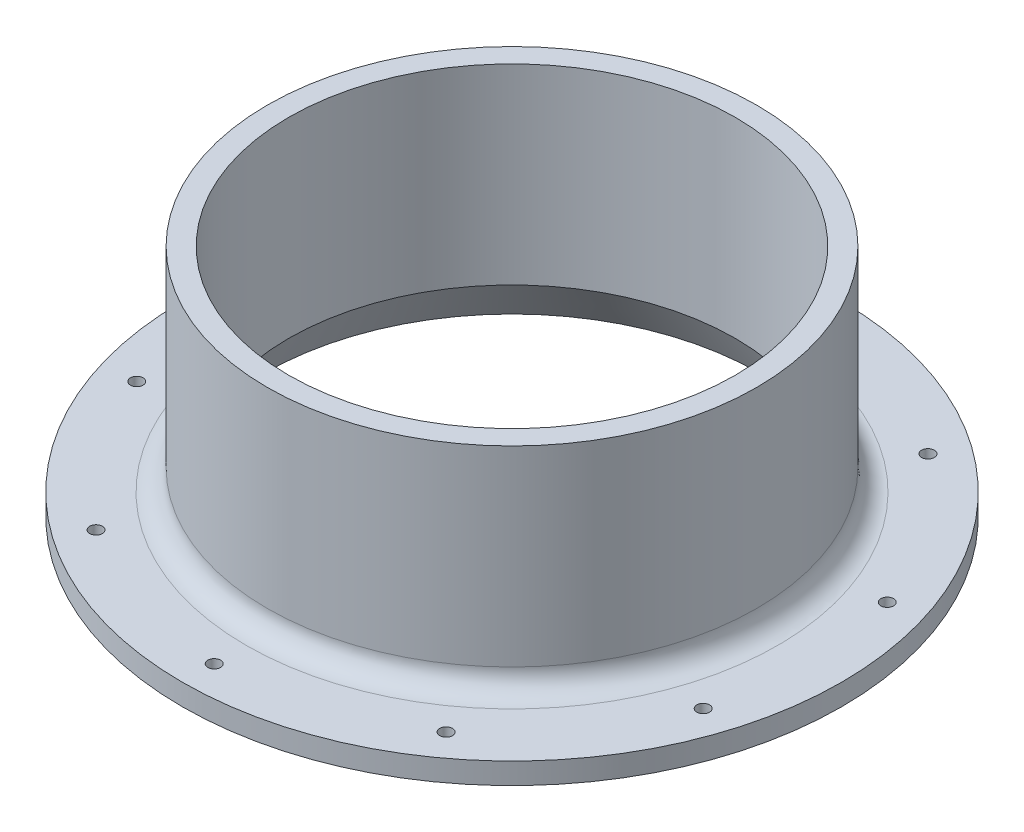
from build123d import *

# Parameters (mm, degrees)
SKETCH2_R                    = 98.425
SKETCH2_R_2                  = 66.675
BOSS_EXTRUDE1_DEPTH          = 6.35
BOSS_EXTRUDE2_START          = 63.5
SKETCH2_3_R                  = 73.025
SKETCH2_3_R_2                = 66.675
BOSS_EXTRUDE2_DEPTH          = 63.5
FILLET1_R                    = 6.35
SKETCH2_5_R                  = 1.9
CUT_EXTRUDE2_DEPTH           = 153.9941543
CHAMFER2_SIZE                = 2.032
CIRPATTERN1_COUNT            = 10
CHAMFER2_OF_CIRPATTERN1_SIZE = 2.032
CHAMFER3_SIZE                = 12.7
CHAMFER3_SIZE2               = 7.332348419


with BuildPart() as part:
    # Sketch2 → Boss-Extrude1 (new body)
    with BuildSketch(Plane(origin=(0, 0, 0), x_dir=(1, 0, 0), z_dir=(0, 1, 0))):
        Circle(SKETCH2_R)
        Circle(SKETCH2_R_2, mode=Mode.SUBTRACT)
    extrude(amount=-BOSS_EXTRUDE1_DEPTH)

    # Sketch2<3> → Boss-Extrude2 (add)
    with BuildSketch(Plane(origin=(0, 0, 0), x_dir=(1, 0, 0), z_dir=(0, 1, 0)).offset(BOSS_EXTRUDE2_START)):
        Circle(SKETCH2_3_R)
        Circle(SKETCH2_3_R_2, mode=Mode.SUBTRACT)
    extrude(amount=-BOSS_EXTRUDE2_DEPTH)

    # Fillet1
    fillet1_edges = [part.edges().sort_by_distance(p)[0] for p in [
        (-73.025, 0, 0),
    ]]
    fillet(fillet1_edges, radius=FILLET1_R)

    # Sketch2<5> → Cut-Extrude2 (cut, through all)
    with BuildSketch(Plane(origin=(0, 0, 0), x_dir=(1, 0, 0), z_dir=(0, 1, 0))):
        with Locations((0, 88.9)):
            Circle(SKETCH2_5_R)
    cut_extrude2 = extrude(amount=-CUT_EXTRUDE2_DEPTH, mode=Mode.SUBTRACT)

    # Chamfer2
    chamfer2_edges = [part.edges().sort_by_distance(p)[0] for p in [
        (-1.9, -6.35, -88.9),
    ]]
    chamfer(chamfer2_edges, length=CHAMFER2_SIZE)

    # CirPattern1: Cut-Extrude2 ×10 about axis
    cirpattern1_axis = Axis((0, 0, 0), (0, 1, 0))
    for i in range(1, CIRPATTERN1_COUNT):
        add(cut_extrude2.rotate(cirpattern1_axis, i * 360 / CIRPATTERN1_COUNT), mode=Mode.SUBTRACT)

    # Chamfer2 of CirPattern1
    chamfer2_of_cirpattern1_edges = [part.edges().sort_by_distance(p)[0] for p in [
        (-53.791241218, -6.35, -70.804818821),
        (-85.136056588, -6.35, -25.664603419),
        (-83.961792009, -6.35, 29.278618181),
        (-50.716976639, -6.35, 73.038402779),
        (1.9, -6.35, 88.9),
        (53.791241218, -6.35, 70.804818821),
        (85.136056588, -6.35, 25.664603419),
        (83.961792009, -6.35, -29.278618181),
        (50.716976639, -6.35, -73.038402779),
    ]]
    chamfer(chamfer2_of_cirpattern1_edges, length=CHAMFER2_OF_CIRPATTERN1_SIZE)

    # Chamfer3
    chamfer3_edges = [part.edges().sort_by_distance(p)[0] for p in [
        (-66.675, -6.35, 0),
    ]]
    chamfer3_side = [part.faces().sort_by_distance(p)[0] for p in [
        (-66.675, 28.575, 0),
    ]]
    chamfer(chamfer3_edges, length=CHAMFER3_SIZE, length2=CHAMFER3_SIZE2, reference=chamfer3_side[0])


solid = part.part
